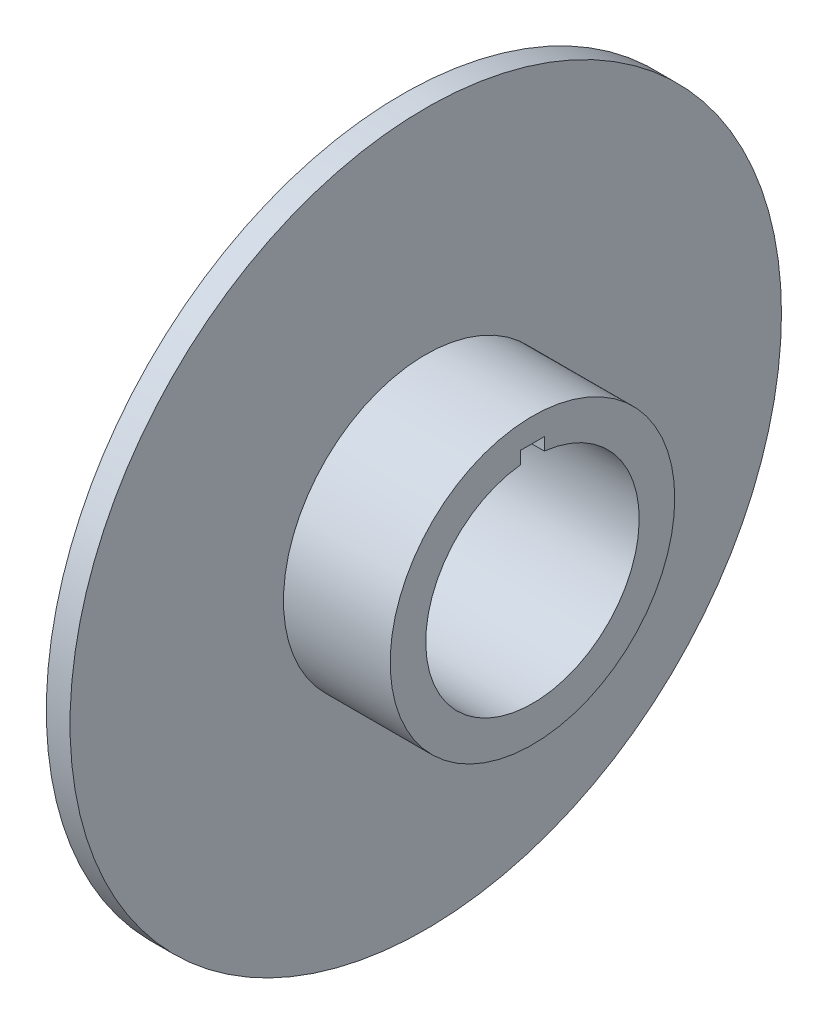
from build123d import *

# Parameters (mm, degrees)
SKETCH1_R           = 60
BOSS_EXTRUDE1_DEPTH = 50
SKETCH1_3_R         = 150
SKETCH1_3_R_2       = 60
BOSS_EXTRUDE2_DEPTH = 5


with BuildPart() as part:
    # Sketch1 → Boss-Extrude1 (new, symmetric)
    with BuildSketch(Plane(origin=(0, 0, 0), x_dir=(0, 0, -1), z_dir=(1, 0, 0))):
        Circle(SKETCH1_R)
        with BuildLine():
            ThreePointArc((45, 0), (-30, -33.541019662), (-5, 44.72135955))
            Line((-5, 44.72135955), (-5, 50))
            Line((-5, 50), (5, 50))
            Line((5, 50), (5, 44.72135955))
            ThreePointArc((5, 44.72135955), (33.541019662, 30), (45, 0))
        make_face(mode=Mode.SUBTRACT)
    extrude(amount=BOSS_EXTRUDE1_DEPTH, both=True)

    # Sketch1<3> → Boss-Extrude2 (add, symmetric)
    with BuildSketch(Plane(origin=(0, 0, 0), x_dir=(0, 0, -1), z_dir=(1, 0, 0))):
        Circle(SKETCH1_3_R)
        Circle(SKETCH1_3_R_2, mode=Mode.SUBTRACT)
    extrude(amount=BOSS_EXTRUDE2_DEPTH, both=True)


solid = part.part
